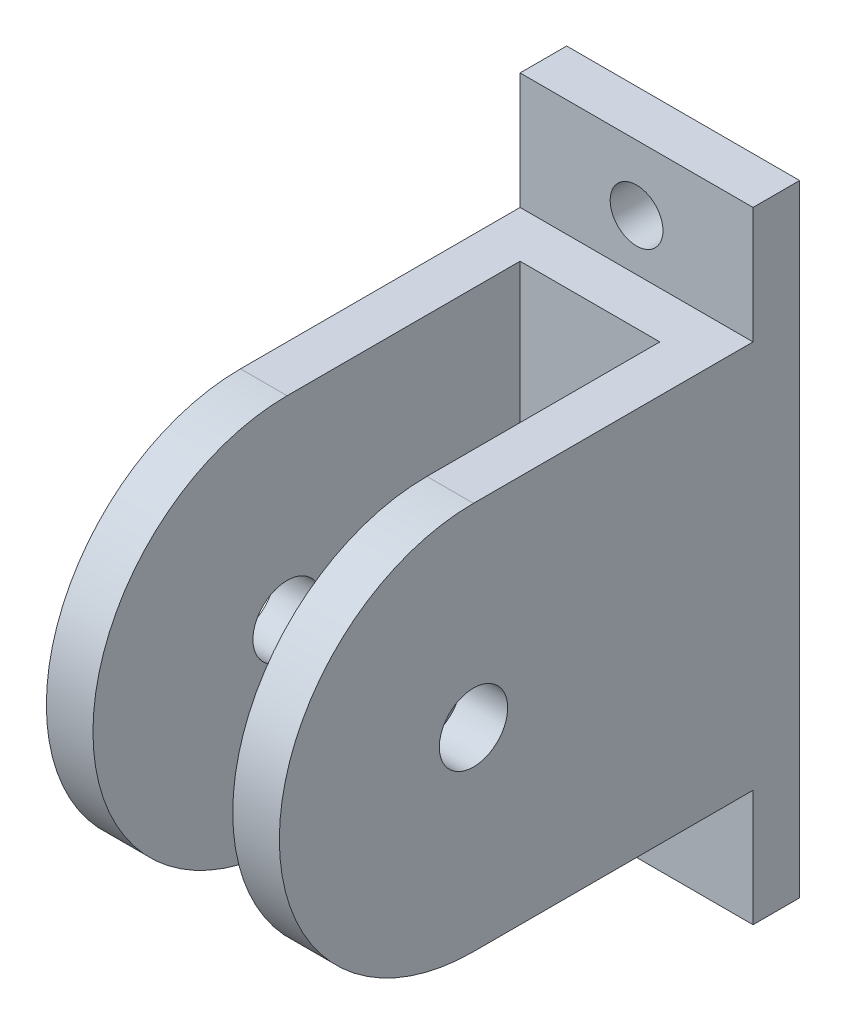
from build123d import *

# Parameters (mm, degrees)
SCHIZZO1_W                    = 15
SCHIZZO1_H                    = 40
ESTRUSIONE_ESTRUSIONE1_DEPTH  = 3
SCHIZZO2_W                    = 15
SCHIZZO2_H                    = 25
ESTRUSIONE_ESTRUSIONE2_DEPTH  = 3
ESTRUSIONE_ESTRUSIONE4_DEPTH  = 3
ESTRUSIONE_ESTRUSIONE5_START  = -3
ESTRUSIONE_ESTRUSIONE5_DEPTH  = 3
TAGLIO_ESTRUSIONE1_DEPTH      = 42.800119617
TAGLIO_ESTRUSIONE1_DEPTH_BACK = 42.800119617
SCHIZZO7_R                    = 2.2
SCHIZZO9_R                    = 1.7
TAGLIO_ESTRUSIONE2_DEPTH      = 7


with BuildPart() as part:
    # Schizzo1 → Estrusione-Estrusione1 (new body)
    with BuildSketch(Plane.XY):
        with Locations((-2.5, 0)):
            Rectangle(SCHIZZO1_W, SCHIZZO1_H)
    extrude(amount=ESTRUSIONE_ESTRUSIONE1_DEPTH)

    # Schizzo2 → Estrusione-Estrusione2 (add)
    with BuildSketch(Plane.XY.offset(3)):
        with Locations((-2.5, 0)):
            Rectangle(SCHIZZO2_W, SCHIZZO2_H)
    extrude(amount=ESTRUSIONE_ESTRUSIONE2_DEPTH)

    # Schizzo5 → Estrusione-Estrusione4 (add)
    with BuildSketch(Plane.ZY.offset(10)):
        with BuildLine():
            Line((6, 12.5), (21, 12.5))
            ThreePointArc((21, 12.5), (33.5, 0), (21, -12.5))
            Line((21, -12.5), (6, -12.5))
            Line((6, -12.5), (6, 12.5))
        make_face()
    extrude(amount=-ESTRUSIONE_ESTRUSIONE4_DEPTH)

    # Schizzo6 → Estrusione-Estrusione5 (add)
    with BuildSketch(Plane(origin=(5, 0, 0), x_dir=(0, 0, -1), z_dir=(1, 0, 0)).offset(ESTRUSIONE_ESTRUSIONE5_START)):
        with BuildLine():
            Line((-6, -12.5), (-6, 12.5))
            Line((-6, 12.5), (-21, 12.5))
            ThreePointArc((-21, 12.5), (-33.5, 0), (-21, -12.5))
            Line((-21, -12.5), (-6, -12.5))
        make_face()
    extrude(amount=ESTRUSIONE_ESTRUSIONE5_DEPTH)

    # Schizzo7 → Taglio-Estrusione1 (cut, two sides: drawn at the far end of the back side and taken through both)
    with BuildSketch(Plane.ZY.offset(10).offset(-TAGLIO_ESTRUSIONE1_DEPTH_BACK)):
        with Locations(Location((21, 0, 0), (0, 0, 270))):
            Circle(SCHIZZO7_R)
    extrude(amount=TAGLIO_ESTRUSIONE1_DEPTH + TAGLIO_ESTRUSIONE1_DEPTH_BACK, mode=Mode.SUBTRACT)

    # Schizzo9 → Taglio-Estrusione2 (cut)
    with BuildSketch(Plane(origin=(0, 0, 0), x_dir=(-1, 0, 0), z_dir=(0, 0, -1))):
        with Locations((2.5, 15.8)):
            Circle(SCHIZZO9_R)
        with Locations(Location((2.5, -15.8, 0), (0, 0, 180))):
            Circle(SCHIZZO9_R)
    extrude(amount=-TAGLIO_ESTRUSIONE2_DEPTH, mode=Mode.SUBTRACT)


solid = part.part
